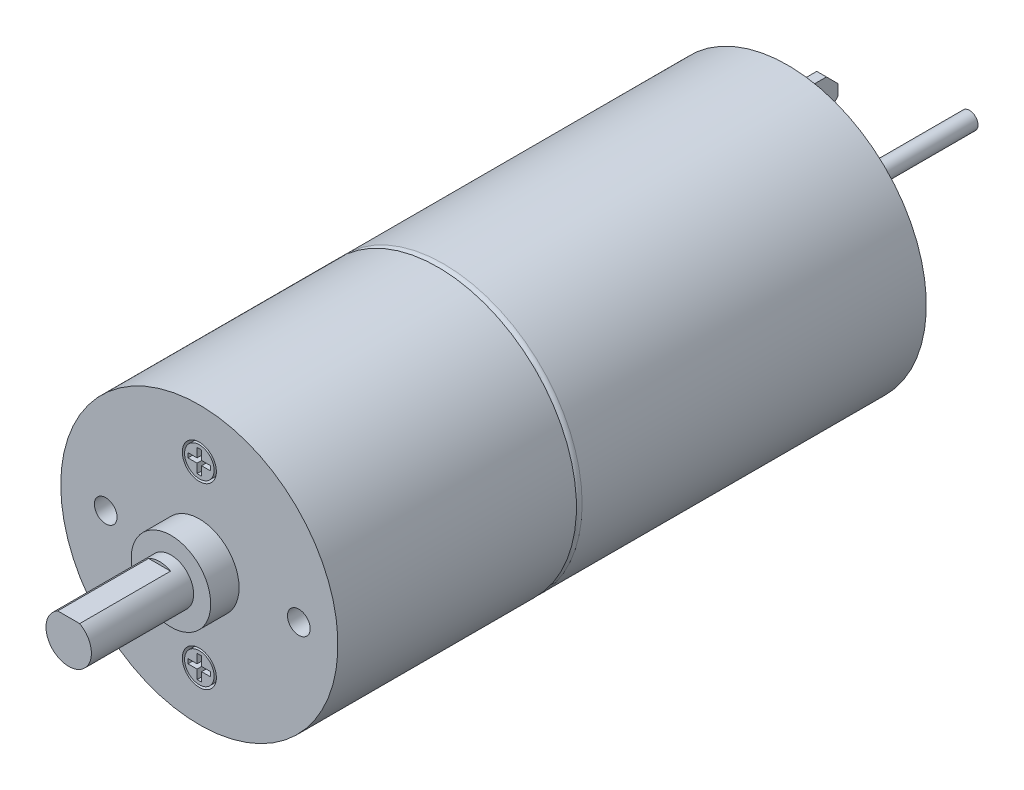
from build123d import *

# Parameters (mm, degrees)
IZIM1_R                     = 12.2
Y_KSEKLIK_EKSTR_ZYON1_DEPTH = 30.8
RADYUS1_R                   = 0.5
IZIM2_R                     = 12.2
Y_KSEKLIK_EKSTR_ZYON2_DEPTH = 21
IZIM3_R                     = 3.5
Y_KSEKLIK_EKSTR_ZYON3_DEPTH = 2.5
IZIM4_R                     = 2
Y_KSEKLIK_EKSTR_ZYON4_DEPTH = 9
IZIM5_R                     = 1
KES_EKSTR_ZYON1_DEPTH       = 10
IZIM6_R                     = 1.5
IZIM6_R_2                   = 1.3
KES_EKSTR_ZYON2_DEPTH       = 1
KES_EKSTR_ZYON3_START       = -8
KES_EKSTR_ZYON3_DEPTH       = 8
IZIM9_R                     = 3.25
Y_KSEKLIK_EKSTR_ZYON5_DEPTH = 1
IZIM10_R                    = 0.75
Y_KSEKLIK_EKSTR_ZYON6_DEPTH = 15
IZIM11_W                    = 0.852537123
IZIM11_H                    = 3
Y_KSEKLIK_EKSTR_ZYON7_DEPTH = 4
IZIM12_R                    = 0.75
KES_EKSTR_ZYON4_DEPTH       = 4
PAH1_SIZE                   = 1


with BuildPart() as part:
    # Çizim1 → Yükseklik-Ekstrüzyon1 (new body)
    with BuildSketch(Plane.XY):
        with Locations((-41.143471688, 10.161406423)):
            Circle(IZIM1_R)
    extrude(amount=Y_KSEKLIK_EKSTR_ZYON1_DEPTH)

    # Radyus1
    radyus1_edges = [part.edges().sort_by_distance(p)[0] for p in [
        (-53.343471688, 10.161406423, 30.8),
    ]]
    fillet(radyus1_edges, radius=RADYUS1_R)

    # Çizim2 → Yükseklik-Ekstrüzyon2 (add)
    with BuildSketch(Plane.XY.offset(30.8)):
        with Locations((-41.143471688, 10.161406423)):
            Circle(IZIM2_R)
    extrude(amount=Y_KSEKLIK_EKSTR_ZYON2_DEPTH)

    # Çizim3 → Yükseklik-Ekstrüzyon3 (add)
    with BuildSketch(Plane.XY.offset(51.8)):
        with Locations((-41.143471688, 10.161406423)):
            Circle(IZIM3_R)
    extrude(amount=Y_KSEKLIK_EKSTR_ZYON3_DEPTH)

    # Çizim4 → Yükseklik-Ekstrüzyon4 (add)
    with BuildSketch(Plane.XY.offset(54.3)):
        with Locations((-41.143471688, 10.161406423)):
            Circle(IZIM4_R)
    extrude(amount=Y_KSEKLIK_EKSTR_ZYON4_DEPTH)

    # Çizim5 → Kes-Ekstrüzyon1 (cut)
    with BuildSketch(Plane.XY.offset(51.8)):
        with Locations((-49.384663885, 10.161406423)):
            Circle(IZIM5_R)
        with Locations((-32.384663885, 10.161406423)):
            Circle(IZIM5_R)
    extrude(amount=-KES_EKSTR_ZYON1_DEPTH, mode=Mode.SUBTRACT)

    # Çizim6 → Kes-Ekstrüzyon2 (cut)
    # profile 1 of 4: a face of its own
    with BuildSketch(Plane.XY.offset(51.8)):
        with Locations((-41.143471688, 2.311406423)):
            Circle(IZIM6_R)
        with Locations((-41.143471688, 2.311406423)):
            Circle(IZIM6_R_2, mode=Mode.SUBTRACT)
    # profile 2 of 4: a face of its own
    with BuildSketch(Plane.XY.offset(51.8)):
        Polygon((-40.943471688, 3.311406423), (-41.343471688, 3.311406423), (-41.343471688, 2.511406423), (-42.143471688, 2.511406423), (-42.143471688, 2.111406423), (-41.343471688, 2.111406423), (-41.343471688, 1.311406423), (-40.943471688, 1.311406423), (-40.943471688, 2.111406423), (-40.143471688, 2.111406423), (-40.143471688, 2.511406423), (-40.943471688, 2.511406423), align=None)
    # profile 3 of 4: a face of its own
    with BuildSketch(Plane.XY.offset(51.8)):
        with Locations((-41.143471688, 18.011406423)):
            Circle(IZIM6_R)
        with Locations((-41.143471688, 18.011406423)):
            Circle(IZIM6_R_2, mode=Mode.SUBTRACT)
    # profile 4 of 4: a face of its own
    with BuildSketch(Plane.XY.offset(51.8)):
        Polygon((-41.343471688, 17.011406423), (-40.943471688, 17.011406423), (-40.943471688, 17.811406423), (-40.143471688, 17.811406423), (-40.143471688, 18.211406423), (-40.943471688, 18.211406423), (-40.943471688, 19.011406423), (-41.343471688, 19.011406423), (-41.343471688, 18.211406423), (-42.143471688, 18.211406423), (-42.143471688, 17.811406423), (-41.343471688, 17.811406423), align=None)
    extrude(amount=-KES_EKSTR_ZYON2_DEPTH, mode=Mode.SUBTRACT)

    # Çizim8 → Kes-Ekstrüzyon3 (cut)
    with BuildSketch(Plane.XY.offset(63.3).offset(KES_EKSTR_ZYON3_START)):
        with BuildLine():
            Line((-42.111717524, 11.911406423), (-40.175225851, 11.911406423))
            ThreePointArc((-40.175225851, 11.911406423), (-41.143471688, 12.161406423), (-42.111717524, 11.911406423))
        make_face()
    extrude(amount=KES_EKSTR_ZYON3_DEPTH, mode=Mode.SUBTRACT)

    # Çizim9 → Yükseklik-Ekstrüzyon5 (add)
    with BuildSketch(Plane(origin=(0, 0, 0), x_dir=(-1, 0, 0), z_dir=(0, 0, -1))):
        with Locations((41.143471688, 10.161406423)):
            Circle(IZIM9_R)
    extrude(amount=Y_KSEKLIK_EKSTR_ZYON5_DEPTH)

    # Çizim10 → Yükseklik-Ekstrüzyon6 (add)
    with BuildSketch(Plane(origin=(0, 0, -1), x_dir=(-1, 0, 0), z_dir=(0, 0, -1))):
        with Locations((41.143471688, 10.161406423)):
            Circle(IZIM10_R)
    extrude(amount=Y_KSEKLIK_EKSTR_ZYON6_DEPTH)

    # Çizim11 → Yükseklik-Ekstrüzyon7 (add)
    with BuildSketch(Plane(origin=(0, 0, 0), x_dir=(-1, 0, 0), z_dir=(0, 0, -1))):
        with Locations((41.159259413, 18.661406423)):
            Rectangle(IZIM11_W, IZIM11_H)
        with Locations((41.159259413, 1.661406423)):
            Rectangle(IZIM11_W, IZIM11_H)
    extrude(amount=Y_KSEKLIK_EKSTR_ZYON7_DEPTH)

    # Çizim12 → Kes-Ekstrüzyon4 (cut)
    with BuildSketch(Plane(origin=(-40.732990851, 0, 0), x_dir=(0, 0, -1), z_dir=(1, 0, 0))):
        with Locations((1.925401768, 18.661406423)):
            Circle(IZIM12_R)
        with Locations((1.925401768, 1.661406423)):
            Circle(IZIM12_R)
    extrude(amount=-KES_EKSTR_ZYON4_DEPTH, mode=Mode.SUBTRACT)

    # Pah1
    pah1_edges = [part.edges().sort_by_distance(p)[0] for p in [
        (-41.159259412, 0.161406423, -4),
        (-41.159259412, 3.161406423, -4),
        (-41.159259412, 20.161406423, -4),
        (-41.159259412, 17.161406423, -4),
    ]]
    chamfer(pah1_edges, length=PAH1_SIZE)


solid = part.part
